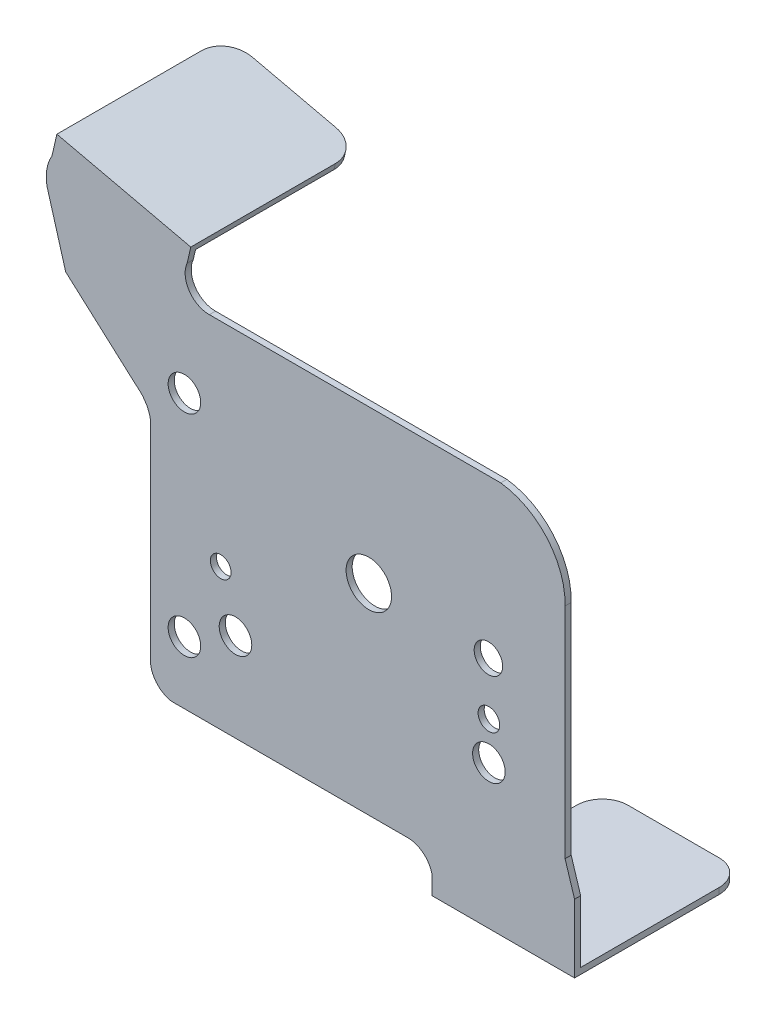
from build123d import *

# Parameters (mm, degrees)
CROQUIS1_R              = 4.430496459
CROQUIS1_R_2            = 2.021537648
CROQUIS1_R_3            = 3.175
CROQUIS1_R_4            = 2.776444448
CROQUIS1_R_5            = 2.106249137
SALIENTE_EXTRUIR1_DEPTH = 1.19
CROQUIS4_W              = 27.78454451
CROQUIS4_H              = 1.19
SALIENTE_EXTRUIR2_DEPTH = 33.19
REDONDEO2_R             = 5


with BuildPart() as part:
    # Croquis1 → Saliente-Extruir1 (new body)
    with BuildSketch(Plane.XY):
        with BuildLine():
            Line((2788.515923591, 1163.062896503), (2845.320282862, 1163.062896503))
            ThreePointArc((2845.320282862, 1163.062896503), (2854.380265752, 1158.219977336), (2857.861371877, 1148.554623946))
            Line((2857.861371877, 1148.554623946), (2857.861371877, 1105.884683704))
            Line((2857.861371877, 1105.884683704), (2859.709564321, 1099.969499723))
            Line((2859.709564321, 1099.969499723), (2859.709564321, 1086.668463787))
            Line((2859.709564321, 1086.668463787), (2831.925019811, 1086.668463787))
            Line((2831.925019811, 1086.668463787), (2831.925019811, 1090.237043102))
            ThreePointArc((2831.925019811, 1090.237043102), (2830.339855276, 1092.909707682), (2827.46732338, 1094.094799688))
            Line((2827.46732338, 1094.094799688), (2781.073788136, 1094.094799688))
            ThreePointArc((2781.073788136, 1094.094799688), (2777.943377157, 1096.10205762), (2777.077273901, 1099.718467781))
            Line((2777.077273901, 1099.718467781), (2777.077273901, 1139.357764533))
            ThreePointArc((2777.077273901, 1139.357764533), (2776.16191908, 1141.931561181), (2774.31245647, 1143.941981956))
            Line((2774.31245647, 1143.941981956), (2760.508490421, 1156.27030536))
            Line((2760.508490421, 1156.27030536), (2756.869619555, 1168.884626052))
            ThreePointArc((2756.869619555, 1168.884626052), (2756.826740412, 1171.777711215), (2757.827792947, 1174.492425601))
            Line((2757.827792947, 1174.492425601), (2758.788780948, 1178.67068333))
            Line((2758.788780948, 1178.67068333), (2784.893128388, 1172.66675387))
            Line((2784.893128388, 1172.66675387), (2784.19129322, 1169.615260811))
            ThreePointArc((2784.19129322, 1169.615260811), (2784.56217485, 1165.156713392), (2788.515923591, 1163.062896503))
        make_face()
        with Locations((2819.601763615, 1133.235396685)):
            Circle(CROQUIS1_R, mode=Mode.SUBTRACT)
        with Locations((2790.727223865, 1121.638053324)):
            Circle(CROQUIS1_R_2, mode=Mode.SUBTRACT)
        with Locations((2783.65094449, 1147.375154376)):
            Circle(CROQUIS1_R_3, mode=Mode.SUBTRACT)
        with Locations((2793.607825607, 1111.419307874)):
            Circle(CROQUIS1_R_3, mode=Mode.SUBTRACT)
        with Locations((2783.65094449, 1106.253651095)):
            Circle(CROQUIS1_R_3, mode=Mode.SUBTRACT)
        with Locations((2842.913546585, 1132.266044758)):
            Circle(CROQUIS1_R_4, mode=Mode.SUBTRACT)
        with Locations((2843.009293559, 1122.033928625)):
            Circle(CROQUIS1_R_5, mode=Mode.SUBTRACT)
        with Locations((2843.009293559, 1114.670632569)):
            Circle(CROQUIS1_R_3, mode=Mode.SUBTRACT)
    extrude(amount=SALIENTE_EXTRUIR1_DEPTH)

    # Croquis4 → Saliente-Extruir2 (add)
    with BuildSketch(Plane.XY.offset(1.19)):
        with Locations((2845.817292066, 1087.263463787)):
            Rectangle(CROQUIS4_W, CROQUIS4_H)
        Polygon((2784.893128388, 1172.66675387), (2784.626395606, 1171.507032515), (2758.522048166, 1177.510961974), (2758.788780948, 1178.67068333), align=None)
    extrude(amount=-SALIENTE_EXTRUIR2_DEPTH)

    # Redondeo2
    redondeo2_edges = [part.edges().sort_by_distance(p)[0] for p in [
        (2784.759761997, 1172.086893193, -32),
        (2758.655414557, 1178.090822652, -32),
        (2831.925019811, 1087.263463787, -32),
        (2859.709564321, 1087.263463787, -32),
    ]]
    fillet(redondeo2_edges, radius=REDONDEO2_R)


solid = part.part
